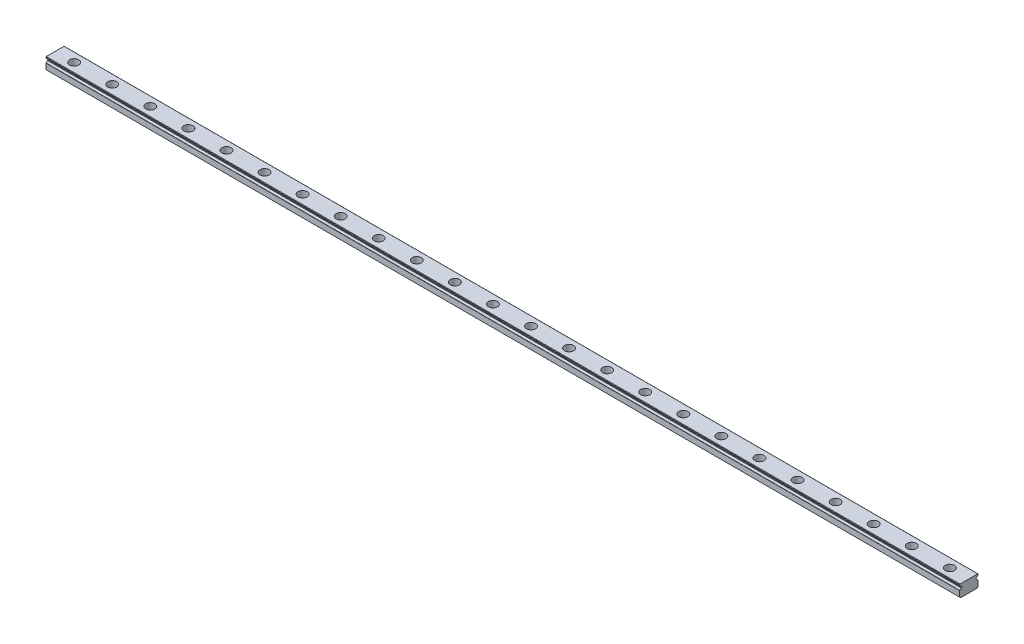
from build123d import *

# Parameters (mm, degrees)
SKETCH_1_W                   = 600
SKETCH_1_H                   = 12
EXTRUDE_1_DEPTH              = 8
CUT_EXTRUDE_1_DEPTH          = 601.043331769
CUT_EXTRUDE_2_DEPTH          = 601.043331769
CUT_EXTRUDE_3_DEPTH          = 601.043331769
CUT_EXTRUDE_4_DEPTH          = 601.043331769
CUT_EXTRUDE_5_DEPTH          = 601.043331769
CUT_EXTRUDE_6_DEPTH          = 601.043331769
HOLE_WIZARD_M3_1_D           = 3.5
HOLE_WIZARD_M3_1_CBORE_D     = 5.9999
HOLE_WIZARD_M3_1_CBORE_DEPTH = 4.5
CHAMFER_1_SIZE               = 0.6
FILLET_1_R                   = 0.2


with BuildPart() as part:
    # 草图1 → 凸台-拉伸1 (new body)
    with BuildSketch(Plane(origin=(0, 4, 0), x_dir=(1, 0, 0), z_dir=(0, 1, 0))):
        Rectangle(SKETCH_1_W, SKETCH_1_H)
    extrude(amount=-EXTRUDE_1_DEPTH)

    # 草图2 → 切除-拉伸1 (cut, through all)
    with BuildSketch(Plane(origin=(300, 0, 0), x_dir=(0, 0, -1), z_dir=(1, 0, 0))):
        with BuildLine():
            Line((6, 1.51), (6, 2.01))
            Line((6, 2.01), (4.8, 2.01))
            ThreePointArc((4.8, 2.01), (4.55, 1.76), (4.8, 1.51))
            Line((4.8, 1.51), (6, 1.51))
        make_face()
    extrude(amount=-CUT_EXTRUDE_1_DEPTH, mode=Mode.SUBTRACT)

    # 草图3 → 切除-拉伸2 (cut, through all)
    with BuildSketch(Plane(origin=(300, 0, 0), x_dir=(0, 0, -1), z_dir=(1, 0, 0))):
        with BuildLine():
            Line((6, 2.01), (6, 3.111111))
            ThreePointArc((6, 3.111111), (5.367595703, 2.693428684), (5.04, 2.01))
            Line((5.04, 2.01), (6, 2.01))
        make_face()
    extrude(amount=-CUT_EXTRUDE_2_DEPTH, mode=Mode.SUBTRACT)

    # 草图4 → 切除-拉伸3 (cut, through all)
    with BuildSketch(Plane(origin=(300, 0, 0), x_dir=(0, 0, -1), z_dir=(1, 0, 0))):
        with BuildLine():
            Line((6, 1.51), (5.04, 1.51))
            ThreePointArc((5.04, 1.51), (5.367595703, 0.826571316), (6, 0.408889))
            Line((6, 0.408889), (6, 1.51))
        make_face()
    extrude(amount=-CUT_EXTRUDE_3_DEPTH, mode=Mode.SUBTRACT)

    # 草图5 → 切除-拉伸4 (cut, through all)
    with BuildSketch(Plane(origin=(300, 0, 0), x_dir=(0, 0, -1), z_dir=(1, 0, 0))):
        with BuildLine():
            Line((-6, 2.01), (-6, 1.51))
            Line((-6, 1.51), (-4.8, 1.51))
            ThreePointArc((-4.8, 1.51), (-4.55, 1.76), (-4.8, 2.01))
            Line((-4.8, 2.01), (-6, 2.01))
        make_face()
    extrude(amount=-CUT_EXTRUDE_4_DEPTH, mode=Mode.SUBTRACT)

    # 草图6 → 切除-拉伸5 (cut, through all)
    with BuildSketch(Plane(origin=(300, 0, 0), x_dir=(0, 0, -1), z_dir=(1, 0, 0))):
        with BuildLine():
            Line((-6, 1.51), (-6, 0.408889))
            ThreePointArc((-6, 0.408889), (-5.367595703, 0.826571316), (-5.04, 1.51))
            Line((-5.04, 1.51), (-6, 1.51))
        make_face()
    extrude(amount=-CUT_EXTRUDE_5_DEPTH, mode=Mode.SUBTRACT)

    # 草图7 → 切除-拉伸6 (cut, through all)
    with BuildSketch(Plane(origin=(300, 0, 0), x_dir=(0, 0, -1), z_dir=(1, 0, 0))):
        with BuildLine():
            Line((-6, 2.01), (-5.04, 2.01))
            ThreePointArc((-5.04, 2.01), (-5.367595703, 2.693428684), (-6, 3.111111))
            Line((-6, 3.111111), (-6, 2.01))
        make_face()
    extrude(amount=-CUT_EXTRUDE_6_DEPTH, mode=Mode.SUBTRACT)

    # M3 六角头机械螺钉的柱形沉头孔1 (through all)
    with Locations(Plane(origin=(0, 4, 0), x_dir=(1, 0, 0), z_dir=(0, 1, 0))):
        with Locations((-287.5, 0), (-262.5, 0), (-237.5, 0), (-212.5, 0), (-187.5, 0), (-162.5, 0), (-137.5, 0), (-112.5, 0), (-87.5, 0), (-62.5, 0), (-37.5, 0), (-12.5, 0), (12.5, 0), (37.5, 0), (62.5, 0), (87.5, 0), (112.5, 0), (137.5, 0), (162.5, 0), (187.5, 0), (212.5, 0), (237.5, 0), (262.5, 0), (287.5, 0)):
            CounterBoreHole(HOLE_WIZARD_M3_1_D / 2, HOLE_WIZARD_M3_1_CBORE_D / 2, HOLE_WIZARD_M3_1_CBORE_DEPTH)

    # 倒角1
    chamfer_1_edges = [part.edges().sort_by_distance(p)[0] for p in [
        (0, -4, -6),
        (0, -4, 6),
    ]]
    chamfer(chamfer_1_edges, length=CHAMFER_1_SIZE)

    # 圆角1
    fillet_1_edges = [part.edges().sort_by_distance(p)[0] for p in [
        (0, 2.01, -5.04),
        (0, 3.111111, -6),
        (0, 0.408889, -6),
        (0, 1.51, -5.04),
        (0, 4, -6),
        (0, 4, 6),
        (0, 1.51, 5.04),
        (0, 0.408889, 6),
        (0, 3.111111, 6),
        (0, 2.01, 5.04),
    ]]
    fillet(fillet_1_edges, radius=FILLET_1_R)


solid = part.part
